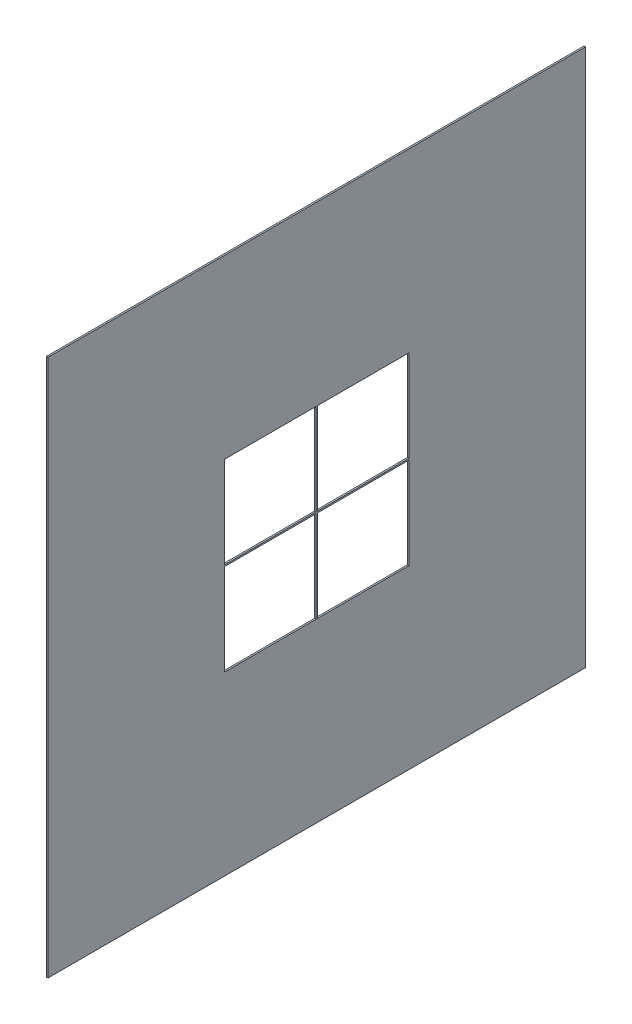
from build123d import *

# Parameters (mm, degrees)
SKETCH1_W           = 3500
SKETCH1_H           = 3500
BOSS_EXTRUDE1_DEPTH = 10
SKETCH2_W           = 595
SKETCH2_H           = 595
CUT_EXTRUDE1_DEPTH  = 10


with BuildPart() as part:
    # Sketch1 → Boss-Extrude1 (new body)
    with BuildSketch(Plane(origin=(0, 0, 0), x_dir=(0, 0, -1), z_dir=(1, 0, 0))):
        Rectangle(SKETCH1_W, SKETCH1_H)
    extrude(amount=BOSS_EXTRUDE1_DEPTH)

    # Sketch2 → Cut-Extrude1 (cut)
    with BuildSketch(Plane(origin=(10, 0, 0), x_dir=(0, 0, -1), z_dir=(1, 0, 0))):
        with Locations((-302.5, -302.5)):
            Rectangle(SKETCH2_W, SKETCH2_H)
        with Locations((-302.5, 302.5)):
            Rectangle(SKETCH2_W, SKETCH2_H)
        with Locations((302.5, -302.5)):
            Rectangle(SKETCH2_W, SKETCH2_H)
        with Locations((302.5, 302.5)):
            Rectangle(SKETCH2_W, SKETCH2_H)
    extrude(amount=-CUT_EXTRUDE1_DEPTH, mode=Mode.SUBTRACT)


solid = part.part
